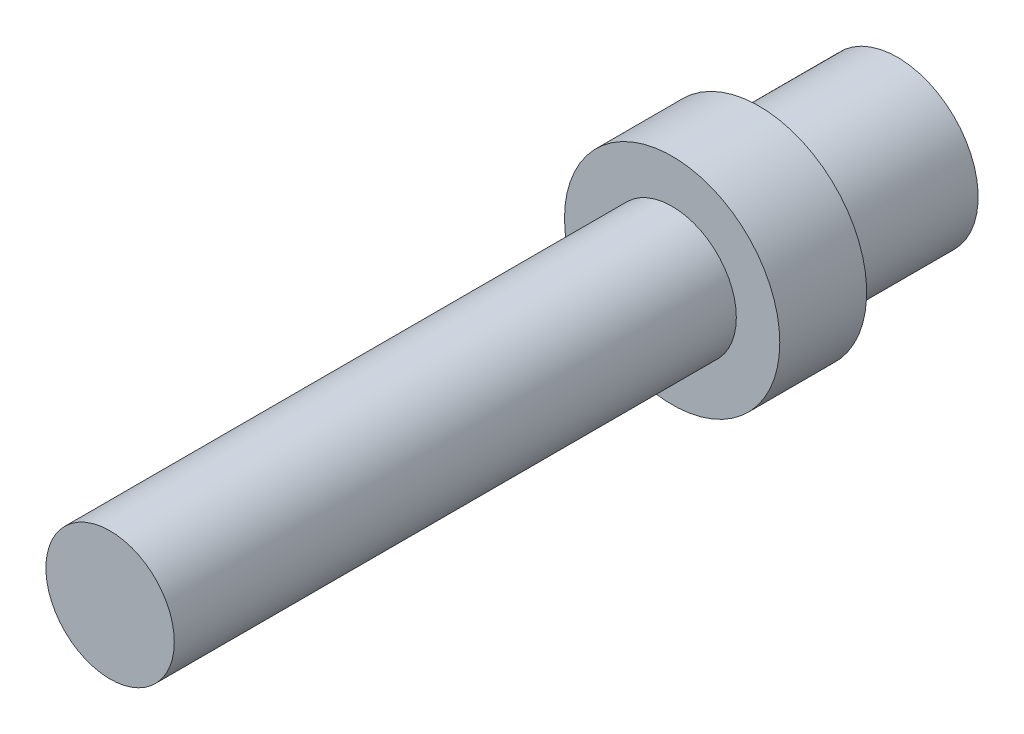
from build123d import *

# Parameters (mm, degrees)
CROQUIS1_R              = 14
SALIENTE_EXTRUIR1_DEPTH = 85
CROQUIS2_OUTSIDE_W      = 48.754
CROQUIS2_OUTSIDE_H      = 48.754
CROQUIS2_OUTSIDE_R      = 10.65
CORTAR_EXTRUIR2_DEPTH   = 18
CORTAR_EXTRUIR3_START   = -55.7
CROQUIS5_R              = 14
CORTAR_EXTRUIR3_DEPTH   = 55.7
CROQUIS6_R              = 8.35
SALIENTE_EXTRUIR2_DEPTH = 73.1
CROQUIS7_OUTSIDE_W      = 51.958
CROQUIS7_OUTSIDE_H      = 51.958
CROQUIS7_OUTSIDE_R      = 10.5
CORTAR_EXTRUIR5_DEPTH   = 18


with BuildPart() as part:
    # Croquis1 → Saliente-Extruir1 (new body)
    with BuildSketch(Plane.XY):
        Circle(CROQUIS1_R)
    extrude(amount=SALIENTE_EXTRUIR1_DEPTH)

    # Croquis2 outside → Cortar-Extruir2 (cut)
    with BuildSketch(Plane(origin=(0, 0, 0), x_dir=(-1, 0, 0), z_dir=(0, 0, -1))):
        Rectangle(CROQUIS2_OUTSIDE_W, CROQUIS2_OUTSIDE_H)
        Circle(CROQUIS2_OUTSIDE_R, mode=Mode.SUBTRACT)
    extrude(amount=-CORTAR_EXTRUIR2_DEPTH, mode=Mode.SUBTRACT)

    # Croquis5 → Cortar-Extruir3 (cut)
    with BuildSketch(Plane.XY.offset(85).offset(CORTAR_EXTRUIR3_START)):
        with Locations(Location((0, 0, 0), (0, 0, 180))):
            Circle(CROQUIS5_R)
    extrude(amount=CORTAR_EXTRUIR3_DEPTH, mode=Mode.SUBTRACT)

    # Croquis6 → Saliente-Extruir2 (add)
    with BuildSketch(Plane.XY.offset(29.3)):
        Circle(CROQUIS6_R)
    extrude(amount=SALIENTE_EXTRUIR2_DEPTH)

    # Croquis7 outside → Cortar-Extruir5 (cut)
    with BuildSketch(Plane(origin=(0, 0, 0), x_dir=(-1, 0, 0), z_dir=(0, 0, -1))):
        Rectangle(CROQUIS7_OUTSIDE_W, CROQUIS7_OUTSIDE_H)
        Circle(CROQUIS7_OUTSIDE_R, mode=Mode.SUBTRACT)
    extrude(amount=-CORTAR_EXTRUIR5_DEPTH, mode=Mode.SUBTRACT)


solid = part.part
